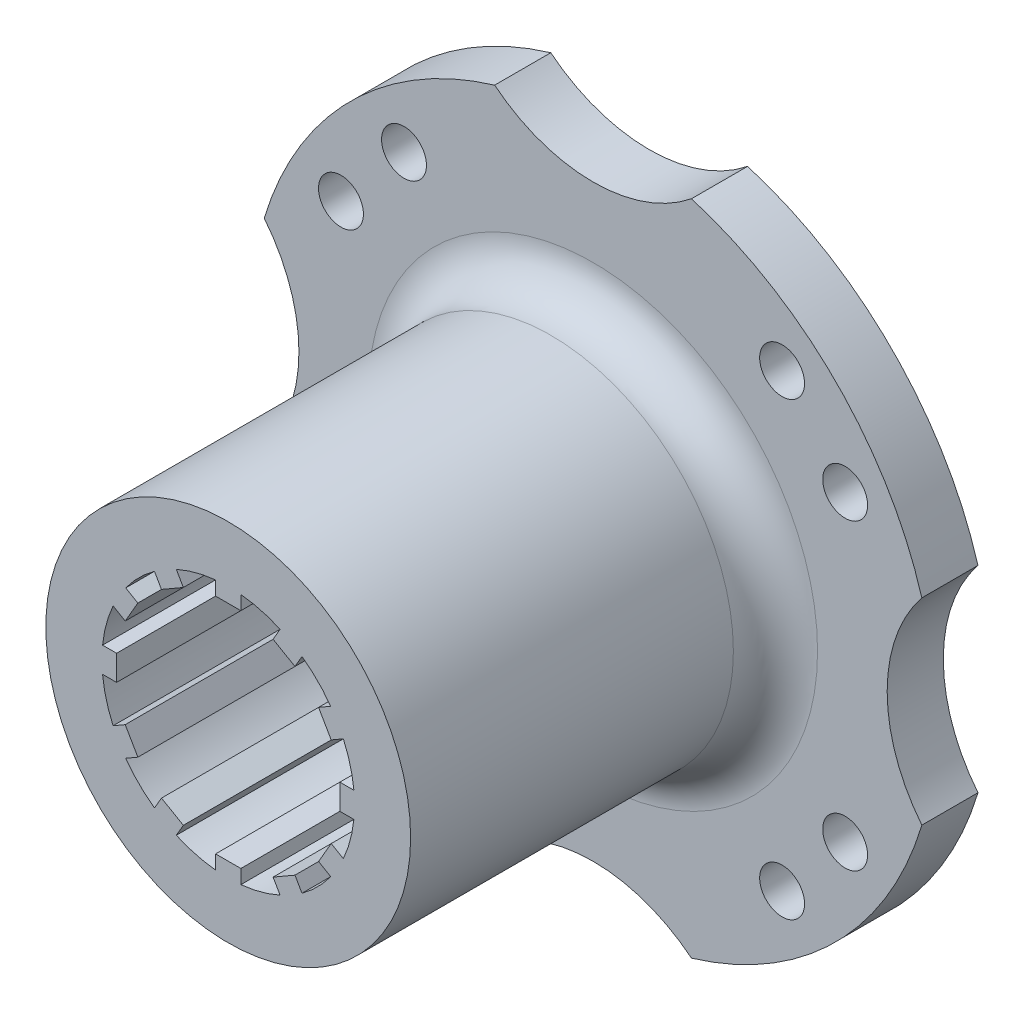
from build123d import *

# Parameters (mm, degrees)
SKETCH1_R           = 8
BOSS_EXTRUDE1_DEPTH = 20
BOSS_EXTRUDE2_START = 20
SKETCH1_3_R         = 65
BOSS_EXTRUDE2_DEPTH = 130
SKETCH2_R           = 55
SKETCH2_R_2         = 30
CUT_EXTRUDE1_DEPTH  = 20
BOSS_EXTRUDE3_START = -20
SKETCH2_2_R         = 55
SKETCH2_2_R_2       = 30
BOSS_EXTRUDE3_DEPTH = 10
FILLET1_R           = 15
FILLET2_R           = 4
FILLET3_R           = 5


with BuildPart() as part:
    # Sketch1 → Boss-Extrude1 (new body)
    with BuildSketch(Plane.XY):
        with BuildLine():
            ThreePointArc((117.165497838, -35.064741783), (104.8, 0), (117.165497838, 35.064741783))
            ThreePointArc((117.165497838, 35.064741783), (86.479159339, 86.479159339), (35.064741783, 117.165497838))
            ThreePointArc((35.064741783, 117.165497838), (0, 104.8), (-35.064741783, 117.165497838))
            ThreePointArc((-35.064741783, 117.165497838), (-86.479159339, 86.479159339), (-117.165497838, 35.064741783))
            ThreePointArc((-117.165497838, 35.064741783), (-104.8, 0), (-117.165497838, -35.064741783))
            ThreePointArc((-117.165497838, -35.064741783), (-86.479159339, -86.479159339), (-35.064741783, -117.165497838))
            ThreePointArc((-35.064741783, -117.165497838), (0, -104.8), (35.064741783, -117.165497838))
            ThreePointArc((35.064741783, -117.165497838), (86.479159339, -86.479159339), (117.165497838, -35.064741783))
        make_face()
        with Locations((-67.364141495, -80.281457639)):
            Circle(SKETCH1_R, mode=Mode.SUBTRACT)
        with Locations((-89.831133114, -53.975990251)):
            Circle(SKETCH1_R, mode=Mode.SUBTRACT)
        with Locations((67.364141495, -80.281457639)):
            Circle(SKETCH1_R, mode=Mode.SUBTRACT)
        with Locations((89.831133114, -53.975990251)):
            Circle(SKETCH1_R, mode=Mode.SUBTRACT)
        with Locations((-89.831133114, 53.975990251)):
            Circle(SKETCH1_R, mode=Mode.SUBTRACT)
        with Locations((-67.364141495, 80.281457639)):
            Circle(SKETCH1_R, mode=Mode.SUBTRACT)
        with Locations((89.831133114, 53.975990251)):
            Circle(SKETCH1_R, mode=Mode.SUBTRACT)
        with Locations((67.364141495, 80.281457639)):
            Circle(SKETCH1_R, mode=Mode.SUBTRACT)
        with BuildLine():
            Line((-4.5, 44.77443467), (-4.5, 39.77443467))
            Line((-4.5, 39.77443467), (4.5, 39.77443467))
            Line((4.5, 39.77443467), (4.5, 44.77443467))
            ThreePointArc((4.5, 44.77443467), (11.64685703, 43.466662183), (18.490103018, 41.025797864))
            Line((18.490103018, 41.025797864), (15.990103018, 36.695670845))
            Line((15.990103018, 36.695670845), (23.784331652, 32.195670845))
            Line((23.784331652, 32.195670845), (26.284331652, 36.525797864))
            ThreePointArc((26.284331652, 36.525797864), (31.819805153, 31.819805153), (36.525797864, 26.284331652))
            Line((36.525797864, 26.284331652), (32.195670845, 23.784331652))
            Line((32.195670845, 23.784331652), (36.695670845, 15.990103018))
            Line((36.695670845, 15.990103018), (41.025797864, 18.490103018))
            ThreePointArc((41.025797864, 18.490103018), (43.466662183, 11.64685703), (44.77443467, 4.5))
            Line((44.77443467, 4.5), (39.77443467, 4.5))
            Line((39.77443467, 4.5), (39.77443467, -4.5))
            Line((39.77443467, -4.5), (44.77443467, -4.5))
            ThreePointArc((44.77443467, -4.5), (43.466662183, -11.64685703), (41.025797864, -18.490103018))
            Line((41.025797864, -18.490103018), (36.695670845, -15.990103018))
            Line((36.695670845, -15.990103018), (32.195670845, -23.784331652))
            Line((32.195670845, -23.784331652), (36.525797864, -26.284331652))
            ThreePointArc((36.525797864, -26.284331652), (31.819805153, -31.819805153), (26.284331652, -36.525797864))
            Line((26.284331652, -36.525797864), (23.784331652, -32.195670845))
            Line((23.784331652, -32.195670845), (15.990103018, -36.695670845))
            Line((15.990103018, -36.695670845), (18.490103018, -41.025797864))
            ThreePointArc((18.490103018, -41.025797864), (11.64685703, -43.466662183), (4.5, -44.77443467))
            Line((4.5, -44.77443467), (4.5, -39.77443467))
            Line((4.5, -39.77443467), (-4.5, -39.77443467))
            Line((-4.5, -39.77443467), (-4.5, -44.77443467))
            ThreePointArc((-4.5, -44.77443467), (-11.64685703, -43.466662183), (-18.490103018, -41.025797864))
            Line((-18.490103018, -41.025797864), (-15.990103018, -36.695670845))
            Line((-15.990103018, -36.695670845), (-23.784331652, -32.195670845))
            Line((-23.784331652, -32.195670845), (-26.284331652, -36.525797864))
            ThreePointArc((-26.284331652, -36.525797864), (-31.819805153, -31.819805153), (-36.525797864, -26.284331652))
            Line((-36.525797864, -26.284331652), (-32.195670845, -23.784331652))
            Line((-32.195670845, -23.784331652), (-36.695670845, -15.990103018))
            Line((-36.695670845, -15.990103018), (-41.025797864, -18.490103018))
            ThreePointArc((-41.025797864, -18.490103018), (-43.466662183, -11.64685703), (-44.77443467, -4.5))
            Line((-44.77443467, -4.5), (-39.77443467, -4.5))
            Line((-39.77443467, -4.5), (-39.77443467, 4.5))
            Line((-39.77443467, 4.5), (-44.77443467, 4.5))
            ThreePointArc((-44.77443467, 4.5), (-43.466662183, 11.64685703), (-41.025797864, 18.490103018))
            Line((-41.025797864, 18.490103018), (-36.695670845, 15.990103018))
            Line((-36.695670845, 15.990103018), (-32.195670845, 23.784331652))
            Line((-32.195670845, 23.784331652), (-36.525797864, 26.284331652))
            ThreePointArc((-36.525797864, 26.284331652), (-31.819805153, 31.819805153), (-26.284331652, 36.525797864))
            Line((-26.284331652, 36.525797864), (-23.784331652, 32.195670845))
            Line((-23.784331652, 32.195670845), (-15.990103018, 36.695670845))
            Line((-15.990103018, 36.695670845), (-18.490103018, 41.025797864))
            ThreePointArc((-18.490103018, 41.025797864), (-11.64685703, 43.466662183), (-4.5, 44.77443467))
        make_face(mode=Mode.SUBTRACT)
    extrude(amount=BOSS_EXTRUDE1_DEPTH)

    # Sketch1<3> → Boss-Extrude2 (add)
    with BuildSketch(Plane.XY.offset(BOSS_EXTRUDE2_START)):
        Circle(SKETCH1_3_R)
        with BuildLine():
            Line((-4.5, 44.77443467), (-4.5, 39.77443467))
            Line((-4.5, 39.77443467), (4.5, 39.77443467))
            Line((4.5, 39.77443467), (4.5, 44.77443467))
            ThreePointArc((4.5, 44.77443467), (11.64685703, 43.466662183), (18.490103018, 41.025797864))
            Line((18.490103018, 41.025797864), (15.990103018, 36.695670845))
            Line((15.990103018, 36.695670845), (23.784331652, 32.195670845))
            Line((23.784331652, 32.195670845), (26.284331652, 36.525797864))
            ThreePointArc((26.284331652, 36.525797864), (31.819805153, 31.819805153), (36.525797864, 26.284331652))
            Line((36.525797864, 26.284331652), (32.195670845, 23.784331652))
            Line((32.195670845, 23.784331652), (36.695670845, 15.990103018))
            Line((36.695670845, 15.990103018), (41.025797864, 18.490103018))
            ThreePointArc((41.025797864, 18.490103018), (43.466662183, 11.64685703), (44.77443467, 4.5))
            Line((44.77443467, 4.5), (39.77443467, 4.5))
            Line((39.77443467, 4.5), (39.77443467, -4.5))
            Line((39.77443467, -4.5), (44.77443467, -4.5))
            ThreePointArc((44.77443467, -4.5), (43.466662183, -11.64685703), (41.025797864, -18.490103018))
            Line((41.025797864, -18.490103018), (36.695670845, -15.990103018))
            Line((36.695670845, -15.990103018), (32.195670845, -23.784331652))
            Line((32.195670845, -23.784331652), (36.525797864, -26.284331652))
            ThreePointArc((36.525797864, -26.284331652), (31.819805153, -31.819805153), (26.284331652, -36.525797864))
            Line((26.284331652, -36.525797864), (23.784331652, -32.195670845))
            Line((23.784331652, -32.195670845), (15.990103018, -36.695670845))
            Line((15.990103018, -36.695670845), (18.490103018, -41.025797864))
            ThreePointArc((18.490103018, -41.025797864), (11.64685703, -43.466662183), (4.5, -44.77443467))
            Line((4.5, -44.77443467), (4.5, -39.77443467))
            Line((4.5, -39.77443467), (-4.5, -39.77443467))
            Line((-4.5, -39.77443467), (-4.5, -44.77443467))
            ThreePointArc((-4.5, -44.77443467), (-11.64685703, -43.466662183), (-18.490103018, -41.025797864))
            Line((-18.490103018, -41.025797864), (-15.990103018, -36.695670845))
            Line((-15.990103018, -36.695670845), (-23.784331652, -32.195670845))
            Line((-23.784331652, -32.195670845), (-26.284331652, -36.525797864))
            ThreePointArc((-26.284331652, -36.525797864), (-31.819805153, -31.819805153), (-36.525797864, -26.284331652))
            Line((-36.525797864, -26.284331652), (-32.195670845, -23.784331652))
            Line((-32.195670845, -23.784331652), (-36.695670845, -15.990103018))
            Line((-36.695670845, -15.990103018), (-41.025797864, -18.490103018))
            ThreePointArc((-41.025797864, -18.490103018), (-43.466662183, -11.64685703), (-44.77443467, -4.5))
            Line((-44.77443467, -4.5), (-39.77443467, -4.5))
            Line((-39.77443467, -4.5), (-39.77443467, 4.5))
            Line((-39.77443467, 4.5), (-44.77443467, 4.5))
            ThreePointArc((-44.77443467, 4.5), (-43.466662183, 11.64685703), (-41.025797864, 18.490103018))
            Line((-41.025797864, 18.490103018), (-36.695670845, 15.990103018))
            Line((-36.695670845, 15.990103018), (-32.195670845, 23.784331652))
            Line((-32.195670845, 23.784331652), (-36.525797864, 26.284331652))
            ThreePointArc((-36.525797864, 26.284331652), (-31.819805153, 31.819805153), (-26.284331652, 36.525797864))
            Line((-26.284331652, 36.525797864), (-23.784331652, 32.195670845))
            Line((-23.784331652, 32.195670845), (-15.990103018, 36.695670845))
            Line((-15.990103018, 36.695670845), (-18.490103018, 41.025797864))
            ThreePointArc((-18.490103018, 41.025797864), (-11.64685703, 43.466662183), (-4.5, 44.77443467))
        make_face(mode=Mode.SUBTRACT)
    extrude(amount=BOSS_EXTRUDE2_DEPTH)

    # Sketch2 → Cut-Extrude1 (cut)
    with BuildSketch(Plane(origin=(0, 0, 0), x_dir=(-1, 0, 0), z_dir=(0, 0, -1))):
        Circle(SKETCH2_R)
        Circle(SKETCH2_R_2, mode=Mode.SUBTRACT)
    extrude(amount=-CUT_EXTRUDE1_DEPTH, mode=Mode.SUBTRACT)

    # Sketch2<2> → Boss-Extrude3 (add)
    with BuildSketch(Plane(origin=(0, 0, 0), x_dir=(-1, 0, 0), z_dir=(0, 0, -1)).offset(BOSS_EXTRUDE3_START)):
        Circle(SKETCH2_2_R)
        Circle(SKETCH2_2_R_2, mode=Mode.SUBTRACT)
    extrude(amount=-BOSS_EXTRUDE3_DEPTH)

    # Fillet1
    fillet1_edges = [part.edges().sort_by_distance(p)[0] for p in [
        (-65, 0, 20),
    ]]
    fillet(fillet1_edges, radius=FILLET1_R)

    # Fillet2
    fillet2_edges = [part.edges().sort_by_distance(p)[0] for p in [
        (30, 0, 30),
        (30, 0, 20),
    ]]
    fillet(fillet2_edges, radius=FILLET2_R)

    # Fillet3
    fillet3_edges = [part.edges().sort_by_distance(p)[0] for p in [
        (55, 0, 20),
    ]]
    fillet(fillet3_edges, radius=FILLET3_R)


solid = part.part
